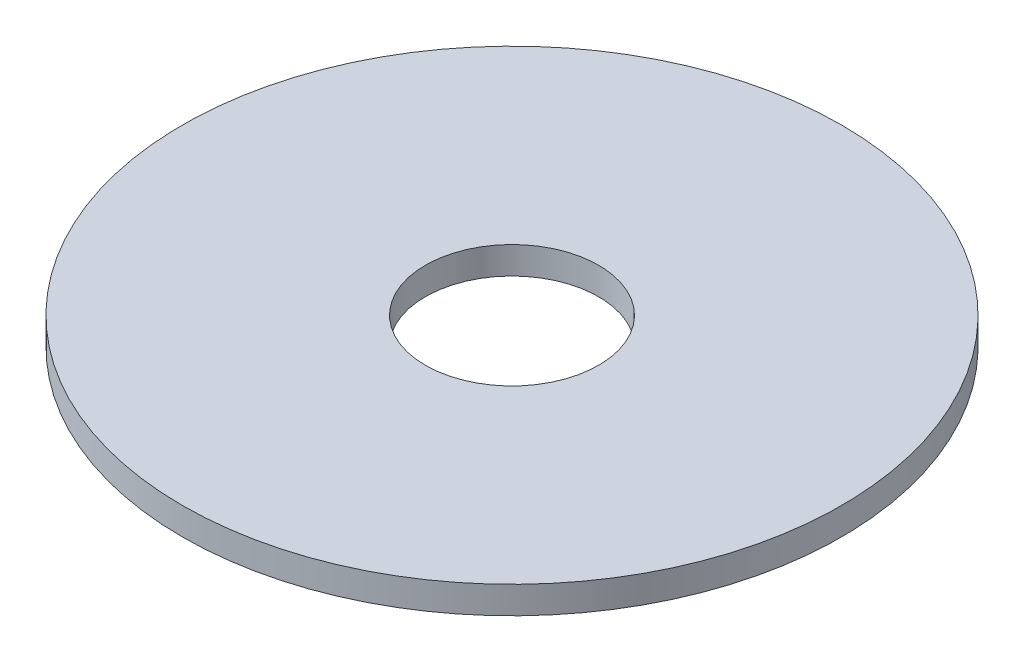
from build123d import *

# Parameters (mm, degrees)
SKETCH1_R           = 24.15
SKETCH1_R_2         = 6.35
BOSS_EXTRUDE1_DEPTH = 2


with BuildPart() as part:
    # Sketch1 → Boss-Extrude1 (new body)
    with BuildSketch(Plane(origin=(0, 0, 0), x_dir=(1, 0, 0), z_dir=(0, 1, 0))):
        with Locations(Location((0, 0, 0), (0, 0, 270))):
            Circle(SKETCH1_R)
        with Locations(Location((0, 0, 0), (0, 0, 270))):
            Circle(SKETCH1_R_2, mode=Mode.SUBTRACT)
    extrude(amount=BOSS_EXTRUDE1_DEPTH)


solid = part.part
